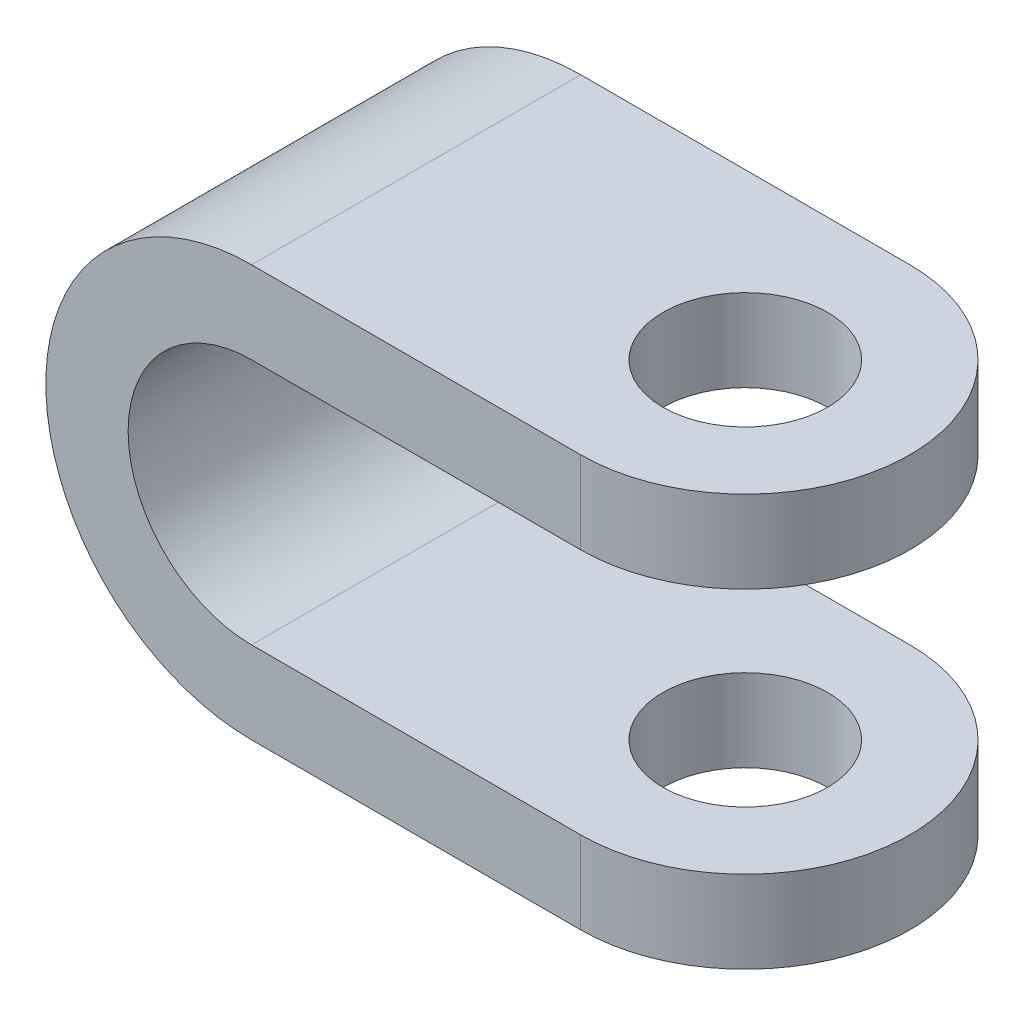
from build123d import *

# Parameters (mm, degrees)
EXTRUDE_THIN1_DEPTH = 90
SKETCH2_R           = 10
BOSS_EXTRUDE1_DEPTH = 90


with BuildPart() as part:
    # Sketch1 → Extrude-Thin1 (new body)
    with BuildSketch(Plane.XY):
        with BuildLine():
            Line((0, -15), (-60, -15))
            ThreePointArc((-60, -15), (-85, -40), (-60, -65))
            Line((-60, -65), (0, -65))
            Line((0, -65), (0, -55))
            Line((0, -55), (-60, -55))
            ThreePointArc((-60, -55), (-75, -40), (-60, -25))
            Line((-60, -25), (0, -25))
            Line((0, -25), (0, -15))
        make_face()
    extrude(amount=EXTRUDE_THIN1_DEPTH)


with BuildPart() as body_2:
    # Sketch2 → Boss-Extrude1 (new body)
    with BuildSketch(Plane(origin=(0, 0, 0), x_dir=(1, 0, 0), z_dir=(0, 1, 0))):
        with BuildLine():
            Line((-85, -25), (-85, -65))
            Line((-85, -65), (-20, -65))
            ThreePointArc((-20, -65), (0, -45), (-20, -25))
            Line((-20, -25), (-85, -25))
        make_face()
        with Locations(Location((-20, -45, 0), (0, 0, 270))):
            Circle(SKETCH2_R, mode=Mode.SUBTRACT)
    extrude(amount=-BOSS_EXTRUDE1_DEPTH)


with BuildPart() as part_1:
    add(part.part)

    # Combine 1: intersect body 2
    add(body_2.part, mode=Mode.INTERSECT)


solid = part_1.part
